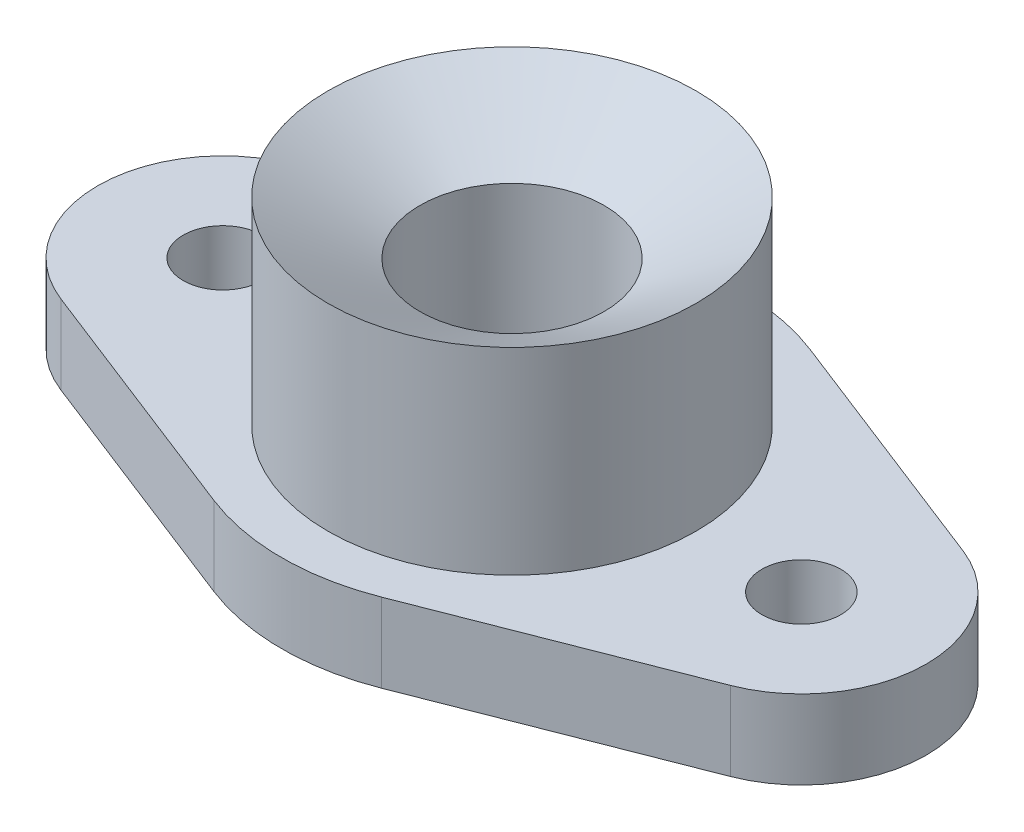
from build123d import *

# Parameters (mm, degrees)
SKETCH1_R           = 6
BOSS_EXTRUDE1_DEPTH = 12
CUT_EXTRUDE1_REACH  = 80.064
SKETCH3_R           = 14


with BuildPart() as part:
    # Sketch1 → Boss-Extrude1 (new body)
    with BuildSketch(Plane(origin=(0, 0, 0), x_dir=(1, 0, 0), z_dir=(0, 1, 0))):
        with BuildLine():
            Line((-50.909090909, 17.699278596), (-12.727272727, 32.603934255))
            ThreePointArc((-12.727272727, 32.603934255), (0, 35), (12.727272727, 32.603934255))
            Line((12.727272727, 32.603934255), (50.909090909, 17.699278596))
            ThreePointArc((50.909090909, 17.699278596), (63, 0), (50.909090909, -17.699278596))
            Line((50.909090909, -17.699278596), (12.727272727, -32.603934255))
            ThreePointArc((12.727272727, -32.603934255), (0, -35), (-12.727272727, -32.603934255))
            Line((-12.727272727, -32.603934255), (-50.909090909, -17.699278596))
            ThreePointArc((-50.909090909, -17.699278596), (-63, 0), (-50.909090909, 17.699278596))
        make_face()
        with Locations(Location((-44, 0, 0), (0, 0, 270))):
            Circle(SKETCH1_R, mode=Mode.SUBTRACT)
        with Locations(Location((44, 0, 0), (0, 0, 270))):
            Circle(SKETCH1_R, mode=Mode.SUBTRACT)
    extrude(amount=BOSS_EXTRUDE1_DEPTH)

    # Sketch2 → Revolve1 (revolve)
    with BuildSketch(Plane.XY, mode=Mode.PRIVATE) as revolve1_sk:
        Polygon((-14, 33.917096231), (-14, 12), (-28, 12), (-28, 42), align=None)
    revolve(revolve1_sk.sketch.rotate(Axis((0, 0, 0), (0, 1, 0)), 270), axis=Axis((0, 0, 0), (0, 1, 0)))

    # Sketch3 → Cut-Extrude1 (cut, up to next)
    with BuildSketch(Plane(origin=(0, 12, 0), x_dir=(1, 0, 0), z_dir=(0, 1, 0)), mode=Mode.PRIVATE) as cut_extrude1_sk1:
        with Locations(Location((0, 0, 0), (0, 0, 90))):
            Circle(SKETCH3_R)
    cut_extrude1_tool1 = extrude(cut_extrude1_sk1.sketch, amount=-CUT_EXTRUDE1_REACH, mode=Mode.PRIVATE) & part.part
    add(cut_extrude1_tool1.solids().sort_by_distance((0, 12, 0))[0], mode=Mode.SUBTRACT)


solid = part.part
